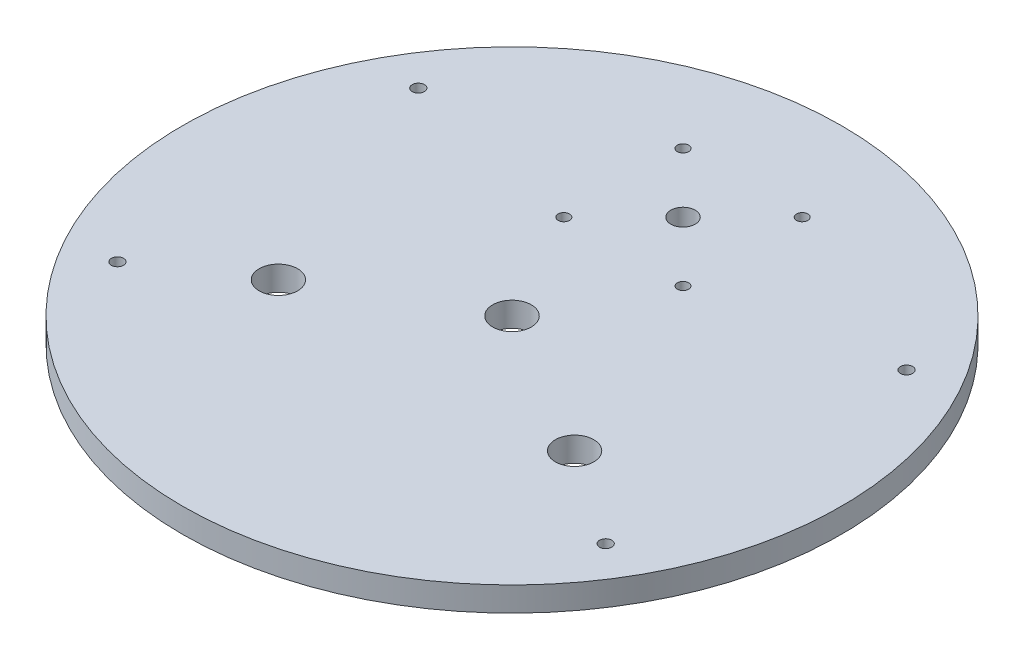
from build123d import *

# Parameters (mm, degrees)
SKETCH1_R           = 85.725
BOSS_EXTRUDE1_DEPTH = 6.35
CUT_EXTRUDE1_REACH  = 123.4
SKETCH2_R           = 1.5875
CUT_EXTRUDE2_REACH  = 123.4
SKETCH3_R           = 3.175
SKETCH3_R_2         = 5
CUT_EXTRUDE3_REACH  = 123.4
SKETCH5_R           = 1.4732
CENTER_HOLE_REACH   = 123.4
SKETCH6_R           = 5.0165


with BuildPart() as part:
    # Sketch1 → Boss-Extrude1 (new body)
    with BuildSketch(Plane(origin=(0, 0, 0), x_dir=(1, 0, 0), z_dir=(0, 1, 0))):
        Circle(SKETCH1_R)
    extrude(amount=BOSS_EXTRUDE1_DEPTH)

    # Sketch2 → Cut-Extrude1 (cut, up to next)
    with BuildSketch(Plane(origin=(0, 6.35, 0), x_dir=(1, 0, 0), z_dir=(0, 1, 0)), mode=Mode.PRIVATE) as cut_extrude1_sk1:
        with Locations((-63.5, 39.13251)):
            Circle(SKETCH2_R)
    cut_extrude1_tool1 = extrude(cut_extrude1_sk1.sketch, amount=-CUT_EXTRUDE1_REACH, mode=Mode.PRIVATE) & part.part
    # Sketch2 → Cut-Extrude1 (cut, up to next)
    with BuildSketch(Plane(origin=(0, 6.35, 0), x_dir=(1, 0, 0), z_dir=(0, 1, 0)), mode=Mode.PRIVATE) as cut_extrude1_sk2:
        with Locations((63.5, 39.13251)):
            Circle(SKETCH2_R)
    cut_extrude1_tool2 = extrude(cut_extrude1_sk2.sketch, amount=-CUT_EXTRUDE1_REACH, mode=Mode.PRIVATE) & part.part
    # Sketch2 → Cut-Extrude1 (cut, up to next)
    with BuildSketch(Plane(origin=(0, 6.35, 0), x_dir=(1, 0, 0), z_dir=(0, 1, 0)), mode=Mode.PRIVATE) as cut_extrude1_sk3:
        with Locations((-63.5, -39.13251)):
            Circle(SKETCH2_R)
    cut_extrude1_tool3 = extrude(cut_extrude1_sk3.sketch, amount=-CUT_EXTRUDE1_REACH, mode=Mode.PRIVATE) & part.part
    # Sketch2 → Cut-Extrude1 (cut, up to next)
    with BuildSketch(Plane(origin=(0, 6.35, 0), x_dir=(1, 0, 0), z_dir=(0, 1, 0)), mode=Mode.PRIVATE) as cut_extrude1_sk4:
        with Locations((63.5, -39.13251)):
            Circle(SKETCH2_R)
    cut_extrude1_tool4 = extrude(cut_extrude1_sk4.sketch, amount=-CUT_EXTRUDE1_REACH, mode=Mode.PRIVATE) & part.part
    add(cut_extrude1_tool1.solids().sort_by_distance((-63.5, 6.35, -39.13251))[0], mode=Mode.SUBTRACT)
    add(cut_extrude1_tool2.solids().sort_by_distance((63.5, 6.35, -39.13251))[0], mode=Mode.SUBTRACT)
    add(cut_extrude1_tool3.solids().sort_by_distance((-63.5, 6.35, 39.13251))[0], mode=Mode.SUBTRACT)
    add(cut_extrude1_tool4.solids().sort_by_distance((63.5, 6.35, 39.13251))[0], mode=Mode.SUBTRACT)

    # Sketch3 → Cut-Extrude2 (cut, up to next)
    with BuildSketch(Plane(origin=(0, 6.35, 0), x_dir=(1, 0, 0), z_dir=(0, 1, 0)), mode=Mode.PRIVATE) as cut_extrude2_sk1:
        with Locations((0, 44.482258)):
            Circle(SKETCH3_R)
    cut_extrude2_tool1 = extrude(cut_extrude2_sk1.sketch, amount=-CUT_EXTRUDE2_REACH, mode=Mode.PRIVATE) & part.part
    # Sketch3 → Cut-Extrude2 (cut, up to next)
    with BuildSketch(Plane(origin=(0, 6.35, 0), x_dir=(1, 0, 0), z_dir=(0, 1, 0)), mode=Mode.PRIVATE) as cut_extrude2_sk2:
        with Locations((-38.522765446, -22.241129)):
            Circle(SKETCH3_R_2)
    cut_extrude2_tool2 = extrude(cut_extrude2_sk2.sketch, amount=-CUT_EXTRUDE2_REACH, mode=Mode.PRIVATE) & part.part
    # Sketch3 → Cut-Extrude2 (cut, up to next)
    with BuildSketch(Plane(origin=(0, 6.35, 0), x_dir=(1, 0, 0), z_dir=(0, 1, 0)), mode=Mode.PRIVATE) as cut_extrude2_sk3:
        with Locations((38.522765446, -22.241129)):
            Circle(SKETCH3_R_2)
    cut_extrude2_tool3 = extrude(cut_extrude2_sk3.sketch, amount=-CUT_EXTRUDE2_REACH, mode=Mode.PRIVATE) & part.part
    add(cut_extrude2_tool1.solids().sort_by_distance((0, 6.35, -44.482258))[0], mode=Mode.SUBTRACT)
    add(cut_extrude2_tool2.solids().sort_by_distance((-38.522765, 6.35, 22.241129))[0], mode=Mode.SUBTRACT)
    add(cut_extrude2_tool3.solids().sort_by_distance((38.522765, 6.35, 22.241129))[0], mode=Mode.SUBTRACT)

    # Sketch5 → Cut-Extrude3 (cut, up to next)
    with BuildSketch(Plane(origin=(0, 6.35, 0), x_dir=(1, 0, 0), z_dir=(0, 1, 0)), mode=Mode.PRIVATE) as cut_extrude3_sk1:
        with Locations((-15.50035, 59.982608)):
            Circle(SKETCH5_R)
    cut_extrude3_tool1 = extrude(cut_extrude3_sk1.sketch, amount=-CUT_EXTRUDE3_REACH, mode=Mode.PRIVATE) & part.part
    # Sketch5 → Cut-Extrude3 (cut, up to next)
    with BuildSketch(Plane(origin=(0, 6.35, 0), x_dir=(1, 0, 0), z_dir=(0, 1, 0)), mode=Mode.PRIVATE) as cut_extrude3_sk2:
        with Locations((15.50035, 59.982608)):
            Circle(SKETCH5_R)
    cut_extrude3_tool2 = extrude(cut_extrude3_sk2.sketch, amount=-CUT_EXTRUDE3_REACH, mode=Mode.PRIVATE) & part.part
    # Sketch5 → Cut-Extrude3 (cut, up to next)
    with BuildSketch(Plane(origin=(0, 6.35, 0), x_dir=(1, 0, 0), z_dir=(0, 1, 0)), mode=Mode.PRIVATE) as cut_extrude3_sk3:
        with Locations((-15.50035, 28.981908)):
            Circle(SKETCH5_R)
    cut_extrude3_tool3 = extrude(cut_extrude3_sk3.sketch, amount=-CUT_EXTRUDE3_REACH, mode=Mode.PRIVATE) & part.part
    # Sketch5 → Cut-Extrude3 (cut, up to next)
    with BuildSketch(Plane(origin=(0, 6.35, 0), x_dir=(1, 0, 0), z_dir=(0, 1, 0)), mode=Mode.PRIVATE) as cut_extrude3_sk4:
        with Locations((15.50035, 28.981908)):
            Circle(SKETCH5_R)
    cut_extrude3_tool4 = extrude(cut_extrude3_sk4.sketch, amount=-CUT_EXTRUDE3_REACH, mode=Mode.PRIVATE) & part.part
    add(cut_extrude3_tool1.solids().sort_by_distance((-15.50035, 6.35, -59.982608))[0], mode=Mode.SUBTRACT)
    add(cut_extrude3_tool2.solids().sort_by_distance((15.50035, 6.35, -59.982608))[0], mode=Mode.SUBTRACT)
    add(cut_extrude3_tool3.solids().sort_by_distance((-15.50035, 6.35, -28.981908))[0], mode=Mode.SUBTRACT)
    add(cut_extrude3_tool4.solids().sort_by_distance((15.50035, 6.35, -28.981908))[0], mode=Mode.SUBTRACT)

    # Sketch6 → center_hole (cut, up to next)
    with BuildSketch(Plane(origin=(0, 6.35, 0), x_dir=(1, 0, 0), z_dir=(0, 1, 0)), mode=Mode.PRIVATE) as center_hole_sk1:
        Circle(SKETCH6_R)
    center_hole_tool1 = extrude(center_hole_sk1.sketch, amount=-CENTER_HOLE_REACH, mode=Mode.PRIVATE) & part.part
    add(center_hole_tool1.solids().sort_by_distance((0, 6.35, 0))[0], mode=Mode.SUBTRACT)


solid = part.part
